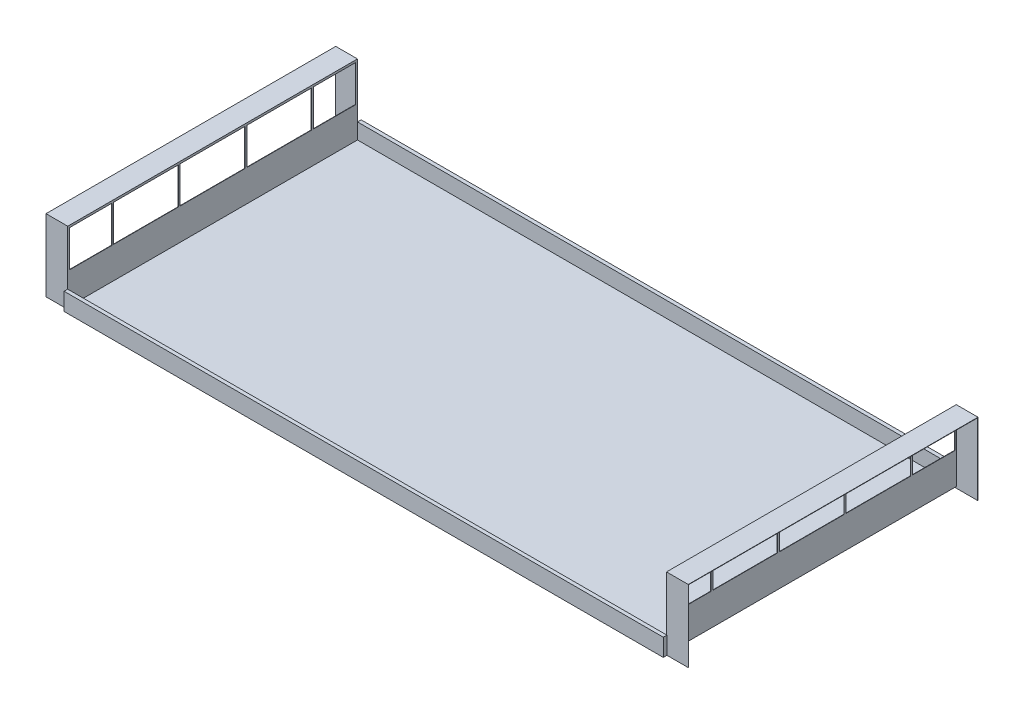
from build123d import *

# Parameters (mm, degrees)
SKETCH1_W                   = 16535.4
SKETCH1_H                   = 8001
BOSS_EXTRUDE1_DEPTH         = 50
SKETCH2_W                   = 600
SKETCH2_H                   = 8001
BOSS_EXTRUDE2_DEPTH         = 1988.82
BOSS_EXTRUDE12_DEPTH        = 482.6
BOSS_EXTRUDE12_DEPTH_BACK   = 1
SKETCH3_W                   = 16546.243074812
SKETCH3_H                   = 100
BOSS_EXTRUDE12_2_DEPTH      = 482.6
BOSS_EXTRUDE12_2_DEPTH_BACK = 1
SHELL1_T                    = -10
SKETCH5_W                   = 1168.26
SKETCH5_H                   = 1008.82
SKETCH5_W_2                 = 1788.16
CUT_EXTRUDE1_DEPTH          = 19067.891386705


with BuildPart() as part:
    # Sketch1 → Boss-Extrude1 (new body)
    with BuildSketch(Plane(origin=(0, 0, 0), x_dir=(1, 0, 0), z_dir=(0, 1, 0))):
        with Locations((8267.7, 4000.5)):
            Rectangle(SKETCH1_W, SKETCH1_H)
    extrude(amount=BOSS_EXTRUDE1_DEPTH)

    # Sketch2 → Boss-Extrude2 (add)
    with BuildSketch(Plane(origin=(0, 0, 0), x_dir=(1, 0, 0), z_dir=(0, 1, 0))):
        with Locations((-300, 4000.5)):
            Rectangle(SKETCH2_W, SKETCH2_H)
        with Locations((16835.4, 4000.5)):
            Rectangle(SKETCH2_W, SKETCH2_H)
    extrude(amount=BOSS_EXTRUDE2_DEPTH)

    # Shell1
    shell1_openings = [part.faces().sort_by_distance(p)[0] for p in [
        (-600, 994.41, -4000.5),
        (17135.4, 994.41, -4000.5),
        (8267.7, 0, -4000.5),
    ]]
    offset(amount=SHELL1_T, openings=shell1_openings, kind=Kind.INTERSECTION)

    # Sketch5 → Cut-Extrude1 (cut, through all)
    with BuildSketch(Plane.ZY.offset(10)):
        with Locations((-7366.87, 1424.41)):
            Rectangle(SKETCH5_W, SKETCH5_H)
        with Locations((-2162.34, 1424.41)):
            Rectangle(SKETCH5_W_2, SKETCH5_H)
        with Locations((-634.13, 1424.41)):
            Rectangle(SKETCH5_W, SKETCH5_H)
        with Locations((-5838.66, 1424.41)):
            Rectangle(SKETCH5_W_2, SKETCH5_H)
        with Locations((-4000.5, 1424.41)):
            Rectangle(SKETCH5_W_2, SKETCH5_H)
    extrude(amount=-CUT_EXTRUDE1_DEPTH, mode=Mode.SUBTRACT)


with BuildPart() as body_2:
    # Sketch3 → Boss-Extrude12 (new, two sides: drawn at the far end of the back side and taken through both)
    with BuildSketch(Plane(origin=(0, 0, 0), x_dir=(1, 0, 0), z_dir=(0, 1, 0)).offset(-BOSS_EXTRUDE12_DEPTH_BACK)):
        with Locations((8273.121537406, 8051)):
            Rectangle(SKETCH3_W, SKETCH3_H)
    extrude(amount=BOSS_EXTRUDE12_DEPTH + BOSS_EXTRUDE12_DEPTH_BACK)


with BuildPart() as body_3:
    # Sketch3 → Boss-Extrude12 2 (new, two sides: drawn at the far end of the back side and taken through both)
    with BuildSketch(Plane(origin=(0, 0, 0), x_dir=(1, 0, 0), z_dir=(0, 1, 0)).offset(-BOSS_EXTRUDE12_2_DEPTH_BACK)):
        with Locations((8273.121537406, -50)):
            Rectangle(SKETCH3_W, SKETCH3_H)
    extrude(amount=BOSS_EXTRUDE12_2_DEPTH + BOSS_EXTRUDE12_2_DEPTH_BACK)


solid = Compound([part.part, body_2.part, body_3.part])
